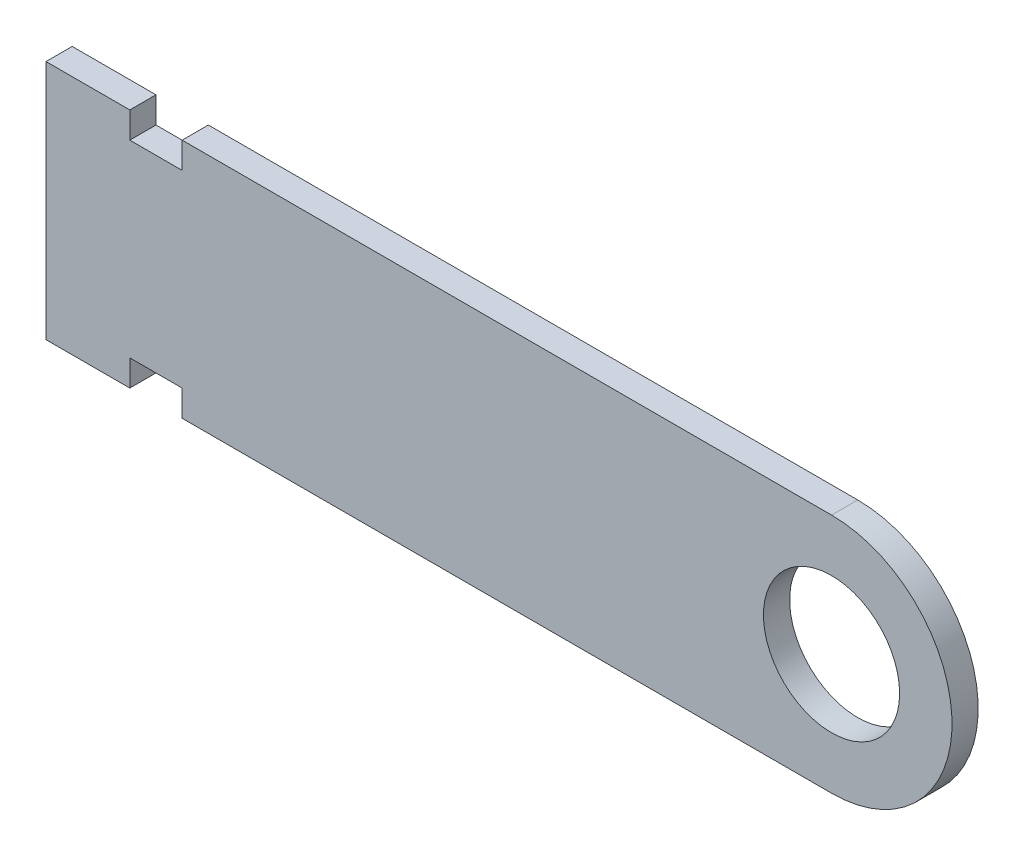
from build123d import *

# Parameters (mm, degrees)
SKETCH1_R           = 13
BOSS_EXTRUDE1_DEPTH = 2.5


with BuildPart() as part:
    # Sketch1 → Boss-Extrude1 (new, symmetric)
    with BuildSketch(Plane.XY):
        with BuildLine():
            Line((16, 23), (0, 23))
            Line((0, 23), (0, -23))
            Line((0, -23), (16, -23))
            Line((16, -23), (16, -18))
            Line((16, -18), (26, -18))
            Line((26, -18), (26, -23))
            Line((26, -23), (150, -23))
            ThreePointArc((150, -23), (173, 0), (150, 23))
            Line((150, 23), (26, 23))
            Line((26, 23), (26, 18))
            Line((26, 18), (16, 18))
            Line((16, 18), (16, 23))
        make_face()
        with Locations((150, 0)):
            Circle(SKETCH1_R, mode=Mode.SUBTRACT)
    extrude(amount=BOSS_EXTRUDE1_DEPTH, both=True)


solid = part.part
